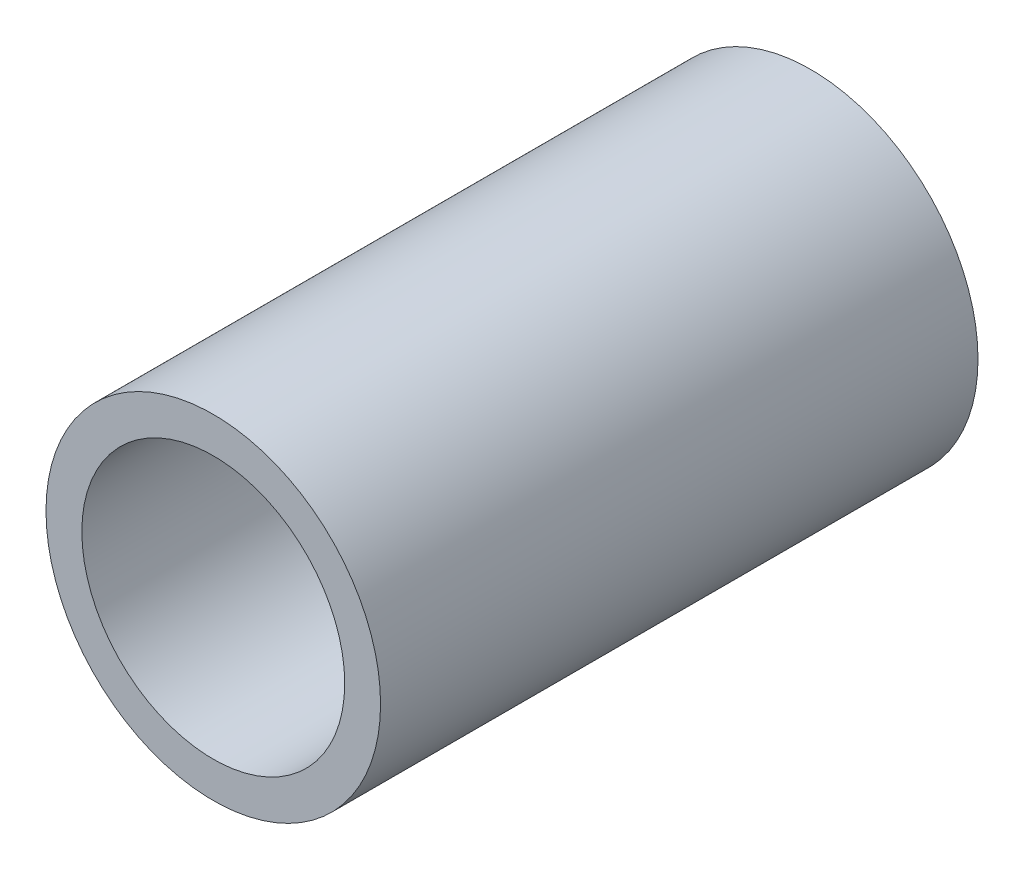
from build123d import *

# Parameters (mm, degrees)
ESBO_O1_R                = 14
ESBO_O1_R_2              = 11
RESSALTO_EXTRUS_O1_DEPTH = 50


with BuildPart() as part:
    # Esboço1 → Ressalto-extrusão1 (new body)
    with BuildSketch(Plane.XY):
        with Locations((2.253649096, 0)):
            Circle(ESBO_O1_R)
        with Locations((2.253649096, 0)):
            Circle(ESBO_O1_R_2, mode=Mode.SUBTRACT)
    extrude(amount=RESSALTO_EXTRUS_O1_DEPTH)


solid = part.part
